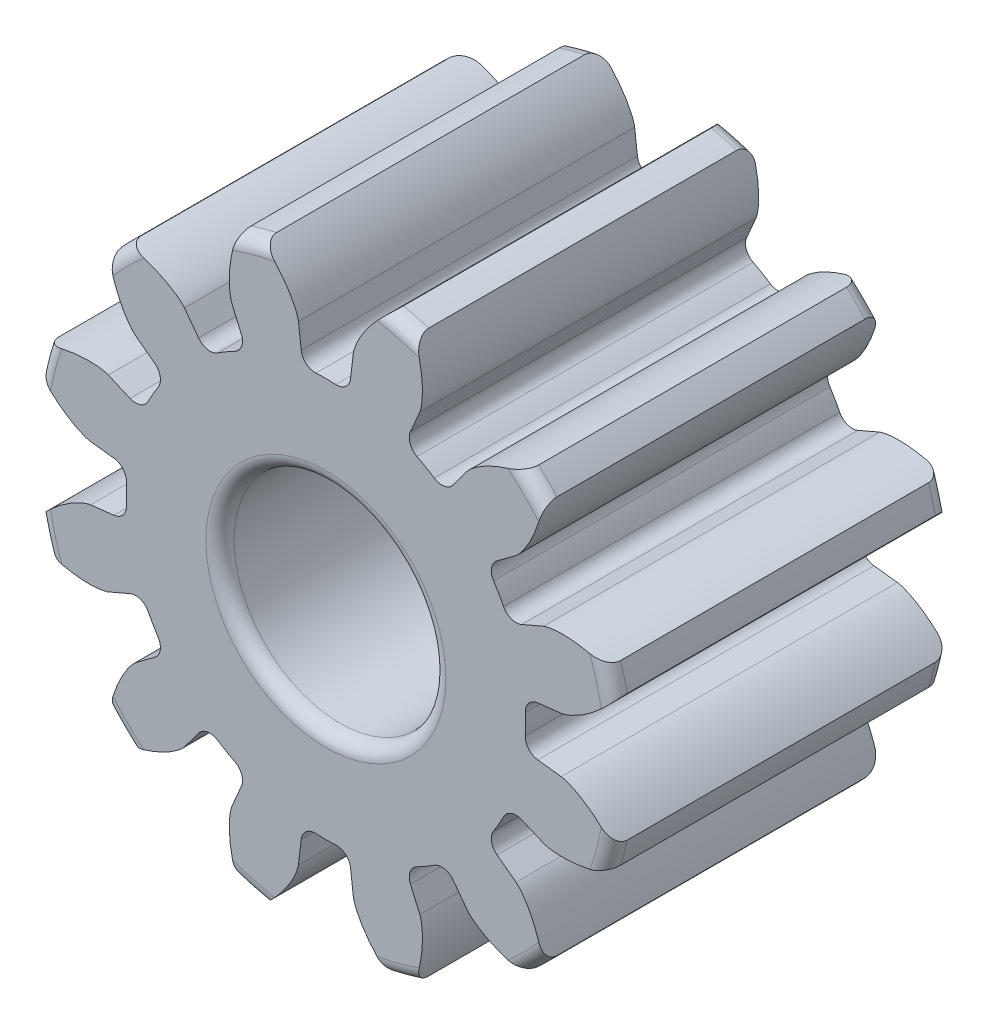
from build123d import *

# Parameters (mm, degrees)
BOSS_EXTRUDE1_DEPTH      = 3.175
BOSS_EXTRUDE1_DEPTH_BACK = 3.175
SKETCH3_R                = 5.55625
SKETCH5_W                = 6.35
SKETCH5_H                = 2.000123
FILLET2_R                = 0.266307122
CUT_EXTRUDE1_DEPTH       = 9.474930994
FILLET1_R                = 0.266307122
CIRPATTERN1_COUNT        = 12
FILLET1_OF_CIRPATTERN1_R = 0.266307122


with BuildPart() as part:
    # Sketch3 → Boss-Extrude1 (new, two sides: drawn at the far end of the back side and taken through both)
    with BuildSketch(Plane.XY.offset(-BOSS_EXTRUDE1_DEPTH_BACK)):
        Circle(SKETCH3_R)
    extrude(amount=BOSS_EXTRUDE1_DEPTH + BOSS_EXTRUDE1_DEPTH_BACK)

    # Sketch5 → Cut-Revolve1 (revolve, cut)
    with BuildSketch(Plane(origin=(0, 0, 0), x_dir=(0, 0, -1), z_dir=(1, 0, 0)), mode=Mode.PRIVATE) as cut_revolve1_sk:
        with Locations((0, 1.0000615)):
            Rectangle(SKETCH5_W, SKETCH5_H)
    revolve(cut_revolve1_sk.sketch.rotate(Axis((0, 0, 3.175), (0, 0, -1)), 90), axis=Axis((0, 0, 3.175), (0, 0, -1)), mode=Mode.SUBTRACT)

    # Fillet2
    fillet2_edges = [part.edges().sort_by_distance(p)[0] for p in [
        (-5.55625, 0, -3.175),
        (-5.55625, 0, 3.175),
        (-2.000123, 0, 3.175),
        (-2.000123, 0, -3.175),
    ]]
    fillet(fillet2_edges, radius=FILLET2_R)

    # Sketch4 → Cut-Extrude1 (cut, symmetric)
    with BuildSketch(Plane.XY):
        with BuildLine():
            Line((3.744976316, 0.436358502), (4.445212559, 0.517948881))
            add(Edge.make_bspline(
                [(4.445212559, 0.517948881), (4.446988643, 0.518183904), (4.451958486, 0.518928669), (4.461305965, 0.520674333), (4.476476085, 0.52400013), (4.495673135, 0.528937043), (4.520313723, 0.536116762), (4.54910084, 0.54559681), (4.580461748, 0.557079488), (4.61425939, 0.570712843), (4.647674072, 0.585316581), (4.680706871, 0.600810831), (4.713330756, 0.617076935), (4.752496873, 0.637754625), (4.798959577, 0.663898969), (4.852488387, 0.696400297), (4.912241535, 0.735537021), (4.972050732, 0.777818405), (5.029985943, 0.821379591), (5.087404852, 0.86760016), (5.142164542, 0.913883496), (5.197824541, 0.964166137), (5.248586848, 1.011708006), (5.304042495, 1.067362637), (5.348387699, 1.112979688), (5.39297093, 1.162057664), (5.414486972, 1.186230835), (5.425405133, 1.198704801)],
                knots=[0, 0, 0, 0, 0, 0.005376749, 0.015083688, 0.02853182, 0.046610139, 0.064854849, 0.092110525, 0.119476176, 0.146842496, 0.174208854, 0.201574956, 0.228941013, 0.256307345, 0.307035032, 0.361767352, 0.416499661, 0.471231937, 0.525964282, 0.580696615, 0.635428982, 0.690161387, 0.744893688, 0.799626082, 0.854358408, 0.909090915, 0.909090915, 0.909090915, 0.909090915, 0.909090915], degree=4))
            ThreePointArc((5.425405133, 1.198704801), (5.55625, 0), (5.425405133, -1.198704801))
            add(Edge.make_bspline(
                [(4.445212559, -0.517948881), (4.446988643, -0.518183904), (4.451958486, -0.518928669), (4.461305965, -0.520674333), (4.476476085, -0.52400013), (4.495673135, -0.528937043), (4.520313723, -0.536116762), (4.54910084, -0.54559681), (4.580461748, -0.557079488), (4.61425939, -0.570712843), (4.647674072, -0.585316581), (4.680706871, -0.600810831), (4.713330756, -0.617076935), (4.752496873, -0.637754625), (4.798959577, -0.663898969), (4.852488387, -0.696400297), (4.912241535, -0.735537021), (4.972050732, -0.777818405), (5.029985943, -0.821379591), (5.087404852, -0.86760016), (5.142164542, -0.913883496), (5.197824541, -0.964166137), (5.248586848, -1.011708006), (5.304042495, -1.067362637), (5.348387699, -1.112979688), (5.39297093, -1.162057664), (5.414486972, -1.186230835), (5.425405133, -1.198704801)],
                knots=[0, 0, 0, 0, 0, 0.005376749, 0.015083688, 0.02853182, 0.046610139, 0.064854849, 0.092110525, 0.119476176, 0.146842496, 0.174208854, 0.201574956, 0.228941013, 0.256307345, 0.307035032, 0.361767352, 0.416499661, 0.471231937, 0.525964282, 0.580696615, 0.635428982, 0.690161387, 0.744893688, 0.799626082, 0.854358408, 0.909090915, 0.909090915, 0.909090915, 0.909090915, 0.909090915], degree=4))
            Line((4.445212559, -0.517948881), (3.744976316, -0.436358502))
            ThreePointArc((3.744976316, -0.436358502), (3.7703125, 0), (3.744976316, 0.436358502))
        make_face()
    cut_extrude1 = extrude(amount=CUT_EXTRUDE1_DEPTH, both=True, mode=Mode.SUBTRACT)

    # Fillet1
    fillet1_edges = [part.edges().sort_by_distance(p)[0] for p in [
        (3.744976316, -0.436358502, 0),
        (3.744976316, 0.436358502, 0),
    ]]
    fillet(fillet1_edges, radius=FILLET1_R)

    # CirPattern1: Cut-Extrude1 ×12 about axis
    cirpattern1_axis = Axis((0, 0, 3.175), (0, 0, -1))
    for i in range(1, CIRPATTERN1_COUNT):
        add(cut_extrude1.rotate(cirpattern1_axis, i * 360 / CIRPATTERN1_COUNT), mode=Mode.SUBTRACT)

    # Fillet1 of CirPattern1
    fillet1_of_cirpattern1_edges = [part.edges().sort_by_distance(p)[0] for p in [
        (3.025065375, -2.250385705, 0),
        (3.461423877, -1.49459061, 0),
        (1.49459061, -3.461423877, 0),
        (2.250385705, -3.025065375, 0),
        (-0.436358502, -3.744976316, 0),
        (0.436358502, -3.744976316, 0),
        (-2.250385705, -3.025065375, 0),
        (-1.49459061, -3.461423877, 0),
        (-3.461423877, -1.49459061, 0),
        (-3.025065375, -2.250385705, 0),
        (-3.744976316, 0.436358502, 0),
        (-3.744976316, -0.436358502, 0),
        (-3.025065375, 2.250385705, 0),
        (-3.461423877, 1.49459061, 0),
        (-1.49459061, 3.461423877, 0),
        (-2.250385705, 3.025065375, 0),
        (0.436358502, 3.744976316, 0),
        (-0.436358502, 3.744976316, 0),
        (2.250385705, 3.025065375, 0),
        (1.49459061, 3.461423877, 0),
        (3.461423877, 1.49459061, 0),
        (3.025065375, 2.250385705, 0),
    ]]
    fillet(fillet1_of_cirpattern1_edges, radius=FILLET1_OF_CIRPATTERN1_R)


solid = part.part
